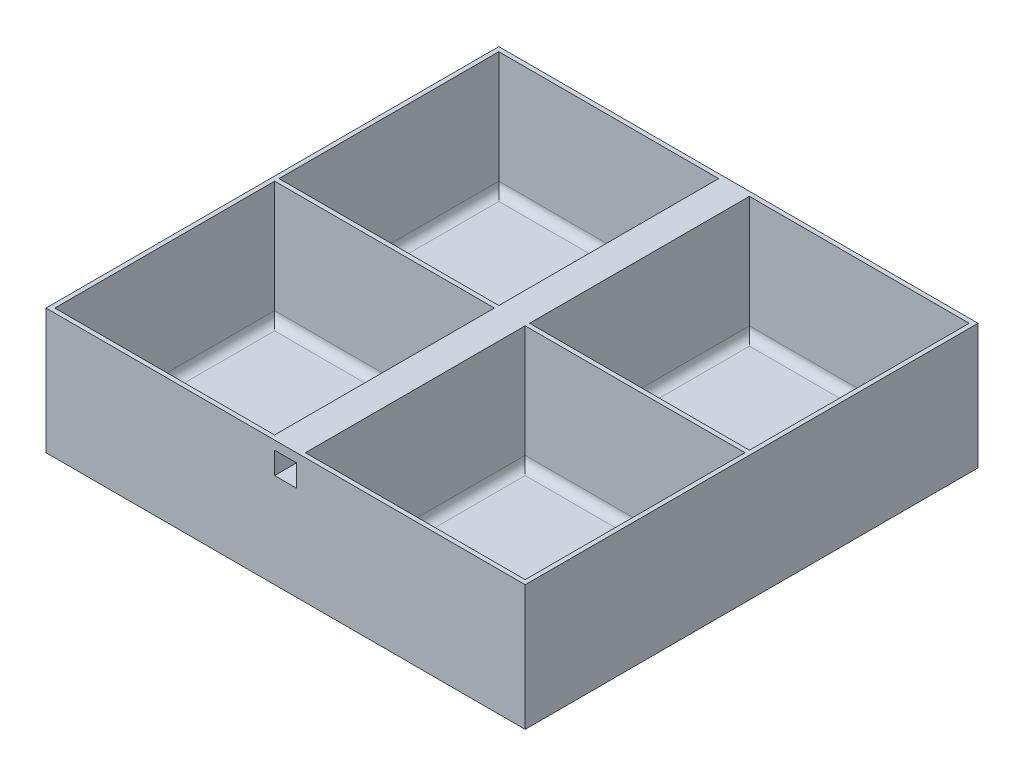
from build123d import *

# Parameters (mm, degrees)
SKETCH1_W           = 218
SKETCH1_H           = 206
SKETCH1_W_2         = 100
SKETCH1_H_2         = 100
BOSS_EXTRUDE1_DEPTH = 57
SKETCH2_W           = 218
SKETCH2_H           = 206
BOSS_EXTRUDE2_DEPTH = 2
FILLET1_R           = 4
SKETCH3_W           = 10
SKETCH3_H           = 10
CUT_EXTRUDE1_DEPTH  = 240.929156211


with BuildPart() as part:
    # Sketch1 → Boss-Extrude1 (new body)
    with BuildSketch(Plane(origin=(0, 0, 0), x_dir=(1, 0, 0), z_dir=(0, 1, 0))):
        Rectangle(SKETCH1_W, SKETCH1_H)
        with Locations((-57, -51)):
            Rectangle(SKETCH1_W_2, SKETCH1_H_2, mode=Mode.SUBTRACT)
        with Locations((57, -51)):
            Rectangle(SKETCH1_W_2, SKETCH1_H_2, mode=Mode.SUBTRACT)
        with Locations((-57, 51)):
            Rectangle(SKETCH1_W_2, SKETCH1_H_2, mode=Mode.SUBTRACT)
        with Locations((57, 51)):
            Rectangle(SKETCH1_W_2, SKETCH1_H_2, mode=Mode.SUBTRACT)
    extrude(amount=BOSS_EXTRUDE1_DEPTH)

    # Sketch2 → Boss-Extrude2 (add)
    with BuildSketch(Plane(origin=(0, 0, 0), x_dir=(1, 0, 0), z_dir=(0, 1, 0))):
        Rectangle(SKETCH2_W, SKETCH2_H)
    extrude(amount=BOSS_EXTRUDE2_DEPTH)

    # Fillet1
    fillet1_edges = [part.edges().sort_by_distance(p)[0] for p in [
        (57, 2, -1),
        (-57, 2, 1),
        (-107, 2, 51),
        (-57, 2, 101),
        (-7, 2, 51),
        (57, 2, 1),
        (7, 2, 51),
        (57, 2, 101),
        (107, 2, 51),
        (-57, 2, -1),
        (-7, 2, -51),
        (-57, 2, -101),
        (-107, 2, -51),
        (107, 2, -51),
        (57, 2, -101),
        (7, 2, -51),
    ]]
    fillet(fillet1_edges, radius=FILLET1_R)

    # Sketch3 → Cut-Extrude1 (cut, through all)
    with BuildSketch(Plane(origin=(0, 0, -103), x_dir=(-1, 0, 0), z_dir=(0, 0, -1))):
        with Locations((0, 48)):
            Rectangle(SKETCH3_W, SKETCH3_H)
    extrude(amount=-CUT_EXTRUDE1_DEPTH, mode=Mode.SUBTRACT)


solid = part.part
